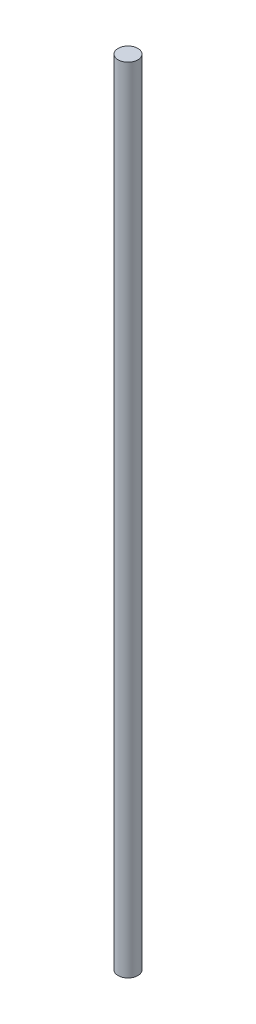
from build123d import *

# Parameters (mm, degrees)
SKETCH1_R           = 5
BOSS_EXTRUDE1_DEPTH = 400


with BuildPart() as part:
    # Sketch1 → Boss-Extrude1 (new body)
    with BuildSketch(Plane(origin=(0, 0, 0), x_dir=(1, 0, 0), z_dir=(0, 1, 0))):
        with Locations(Location((0, 0, 0), (0, 0, 270))):
            Circle(SKETCH1_R)
    extrude(amount=BOSS_EXTRUDE1_DEPTH)


solid = part.part
